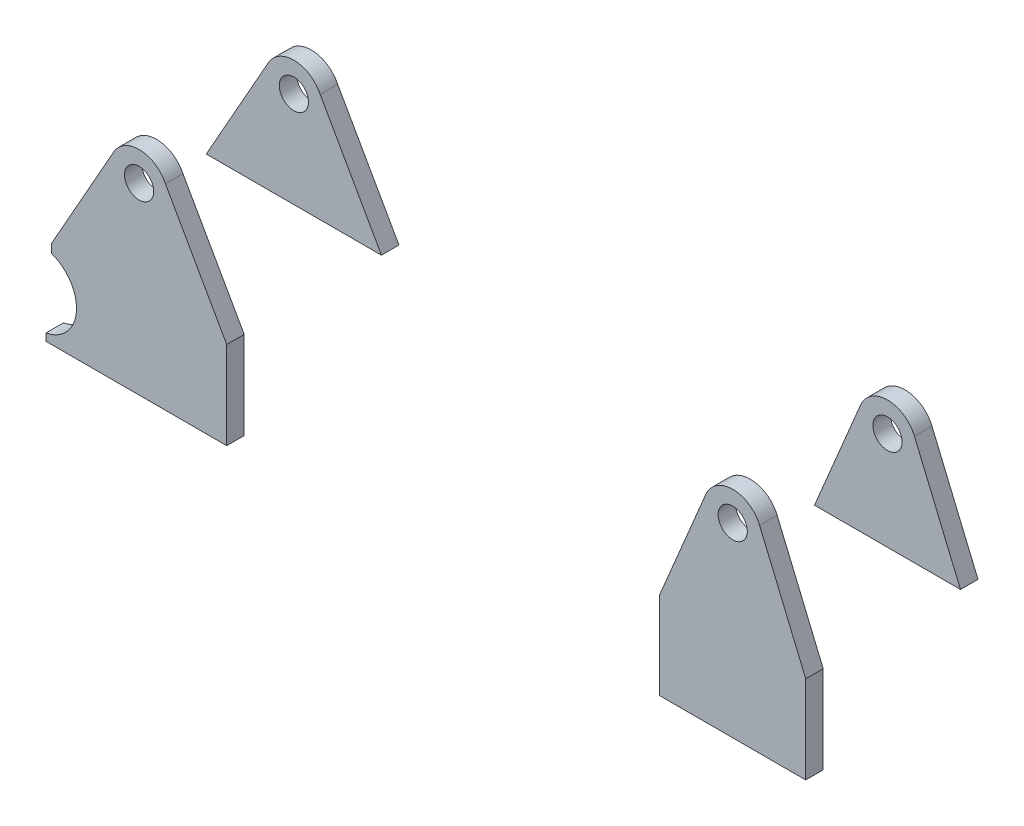
from build123d import *

# Parameters (mm, degrees)
SKETCH1_W             = 50
SKETCH1_H             = 30
BOSS_EXTRUDE1_DEPTH   = 6
SKETCH2_R             = 5
BOSS_EXTRUDE2_DEPTH   = 6
BOSS_EXTRUDE2_2_DEPTH = 6


with BuildPart() as part:
    # Sketch1 → Boss-Extrude1 (new body)
    # profile 1 of 6: a face of its own
    with BuildSketch(Plane.XY):
        with BuildLine():
            Line((-716.139861216, -515.57575128), (-737.428628659, -553.340939136))
            Line((-737.428628659, -553.340939136), (-677.428628659, -553.340939136))
            Line((-677.428628659, -553.340939136), (-698.394613553, -516.198439056))
            ThreePointArc((-698.394613553, -516.198439056), (-697.673113525, -518.288686656), (-697.428628659, -520.486395569))
            ThreePointArc((-697.428628659, -520.486395569), (-709.967100091, -530.158839045), (-716.139861216, -515.57575128))
        make_face()
    # profile 2 of 6: a face of its own
    with BuildSketch(Plane.XY):
        with BuildLine():
            Line((-677.428628659, -553.340939136), (-737.428628659, -553.340939136))
            Line((-737.428628659, -553.340939136), (-737.428628659, -556.331866841))
            ThreePointArc((-737.428628659, -556.331866841), (-731.221893717, -560.964753297), (-728.860193105, -568.341037305))
            ThreePointArc((-728.860193105, -568.341037305), (-731.818315199, -576.488786373), (-739.314652141, -580.840939136))
            Line((-739.314652141, -580.840939136), (-739.314652141, -583.340939136))
            Line((-739.314652141, -583.340939136), (-677.428628659, -583.340939136))
            Line((-677.428628659, -583.340939136), (-677.428628659, -553.340939136))
        make_face()
    # profile 3 of 6: a face of its own
    with BuildSketch(Plane.XY):
        with BuildLine():
            ThreePointArc((-698.394613553, -516.198439056), (-707.077940535, -510.492546569), (-716.139861216, -515.57575128))
            ThreePointArc((-716.139861216, -515.57575128), (-709.967100091, -530.158839045), (-697.428628659, -520.486395569))
            ThreePointArc((-697.428628659, -520.486395569), (-697.673113525, -518.288686656), (-698.394613553, -516.198439056))
        make_face()
        with BuildLine():
            add(Edge.make_bspline(
                [(-702.428724913, -520.517420238), (-702.366675575, -510.517612746), (-712.366483068, -510.455563408), (-712.428532405, -520.4553709), (-712.490581742, -530.455178393), (-702.49077425, -530.51722773), (-702.428724913, -520.517420238)],
                knots=[0, 0, 0, 0, 0.5, 0.5, 0.5, 1, 1, 1, 1], degree=3, weights=[1, 0.333333333, 0.333333333, 1, 0.333333333, 0.333333333, 1]))
        make_face(mode=Mode.SUBTRACT)
    # profile 4 of 6: a face of its own
    with BuildSketch(Plane.XY):
        with BuildLine():
            Line((-513.347374444, -515.745502459), (-529.126603186, -553.340939136))
            Line((-529.126603186, -553.340939136), (-479.126603186, -553.340939136))
            Line((-479.126603186, -553.340939136), (-494.905831928, -515.745502459))
            ThreePointArc((-494.905831928, -515.745502459), (-494.323345754, -517.641698969), (-494.126603186, -519.615564139))
            ThreePointArc((-494.126603186, -519.615564139), (-506.100468357, -529.418821572), (-513.347374444, -515.745502459))
        make_face()
    # profile 5 of 6: a face of its own
    with BuildSketch(Plane.XY):
        with Locations((-504.126603186, -568.340939136)):
            Rectangle(SKETCH1_W, SKETCH1_H)
    # profile 6 of 6: a face of its own
    with BuildSketch(Plane.XY):
        with BuildLine():
            ThreePointArc((-494.905831928, -515.745502459), (-504.126603186, -509.615564139), (-513.347374444, -515.745502459))
            ThreePointArc((-513.347374444, -515.745502459), (-506.100468357, -529.418821572), (-494.126603186, -519.615564139))
            ThreePointArc((-494.126603186, -519.615564139), (-494.323345754, -517.641698969), (-494.905831928, -515.745502459))
        make_face()
        with BuildLine():
            add(Edge.make_bspline(
                [(-499.12669944, -519.646588808), (-499.064650103, -509.646781316), (-509.064457595, -509.584731979), (-509.126506932, -519.584539471), (-509.188556269, -529.584346963), (-499.188748777, -529.6463963), (-499.12669944, -519.646588808)],
                knots=[0, 0, 0, 0, 0.5, 0.5, 0.5, 1, 1, 1, 1], degree=3, weights=[1, 0.333333333, 0.333333333, 1, 0.333333333, 0.333333333, 1]))
        make_face(mode=Mode.SUBTRACT)
    extrude(amount=BOSS_EXTRUDE1_DEPTH)


with BuildPart() as body_2:
    # Sketch2 → Boss-Extrude2 (new body)
    with BuildSketch(Plane(origin=(0, 0, -47), x_dir=(-1, 0, 0), z_dir=(0, 0, -1))):
        with BuildLine():
            Line((677.428628659, -553.340939136), (737.428628659, -553.340939136))
            Line((737.428628659, -553.340939136), (716.139861216, -515.57575128))
            ThreePointArc((716.139861216, -515.57575128), (707.077940535, -510.492546569), (698.394613553, -516.198439056))
            Line((698.394613553, -516.198439056), (677.428628659, -553.340939136))
        make_face()
        with Locations((707.428628659, -520.486395569)):
            Circle(SKETCH2_R, mode=Mode.SUBTRACT)
    extrude(amount=BOSS_EXTRUDE2_DEPTH)


with BuildPart() as body_3:
    # Sketch2 → Boss-Extrude2 2 (new body)
    with BuildSketch(Plane(origin=(0, 0, -47), x_dir=(-1, 0, 0), z_dir=(0, 0, -1))):
        with BuildLine():
            Line((479.126603186, -553.340939136), (529.126603186, -553.340939136))
            Line((529.126603186, -553.340939136), (513.347374444, -515.745502459))
            ThreePointArc((513.347374444, -515.745502459), (504.126603186, -509.615564139), (494.905831928, -515.745502459))
            Line((494.905831928, -515.745502459), (479.126603186, -553.340939136))
        make_face()
        with Locations((504.126603186, -519.615564139)):
            Circle(SKETCH2_R, mode=Mode.SUBTRACT)
    extrude(amount=BOSS_EXTRUDE2_2_DEPTH)


solid = Compound([part.part, body_2.part, body_3.part])
